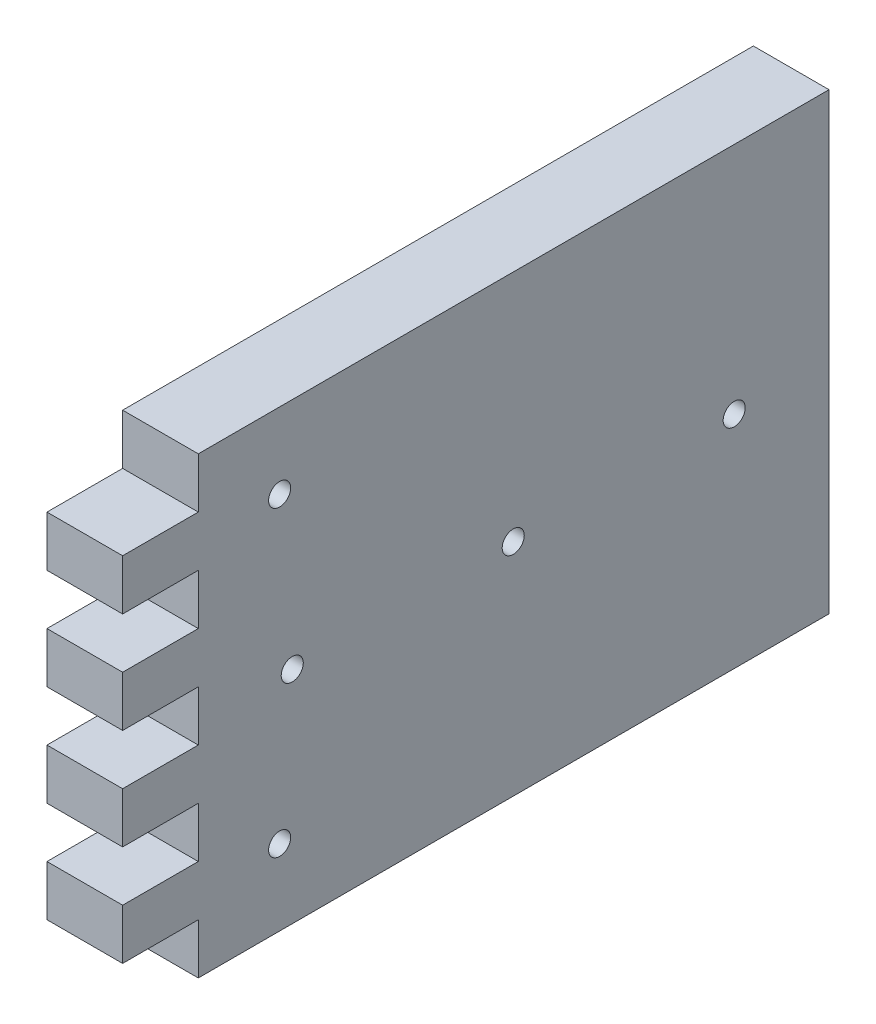
from build123d import *

# Parameters (mm, degrees)
BOSS_EXTRUDE1_DEPTH             = 19.05
F_7_32_0_21875_DIAMETER_HOLE3_D = 5.55625


with BuildPart() as part:
    # Sketch1 → Boss-Extrude1 (new body)
    with BuildSketch(Plane(origin=(0, 0, 0), x_dir=(0, 0, -1), z_dir=(1, 0, 0))):
        Polygon((19.05, 0), (177.8635, 0), (177.8635, 114.3), (19.05, 114.3), (19.05, 101.6), (0, 101.6), (0, 88.9), (19.05, 88.9), (19.05, 76.2), (0, 76.2), (0, 63.5), (19.05, 63.5), (19.05, 50.8), (0, 50.8), (0, 38.1), (19.05, 38.1), (19.05, 25.4), (0, 25.4), (0, 12.7), (19.05, 12.7), align=None)
    extrude(amount=BOSS_EXTRUDE1_DEPTH)

    # 7/32 (0.21875) Diameter Hole3 (through all)
    with Locations(Plane(origin=(19.05, 0, 0), x_dir=(0, 0, -1), z_dir=(1, 0, 0))):
        with Locations((39.5351, 19.05), (153.9875, 55.499), (98.3488, 55.499), (42.7101, 55.499), (39.5351, 95.25)):
            Hole(F_7_32_0_21875_DIAMETER_HOLE3_D / 2)


solid = part.part
